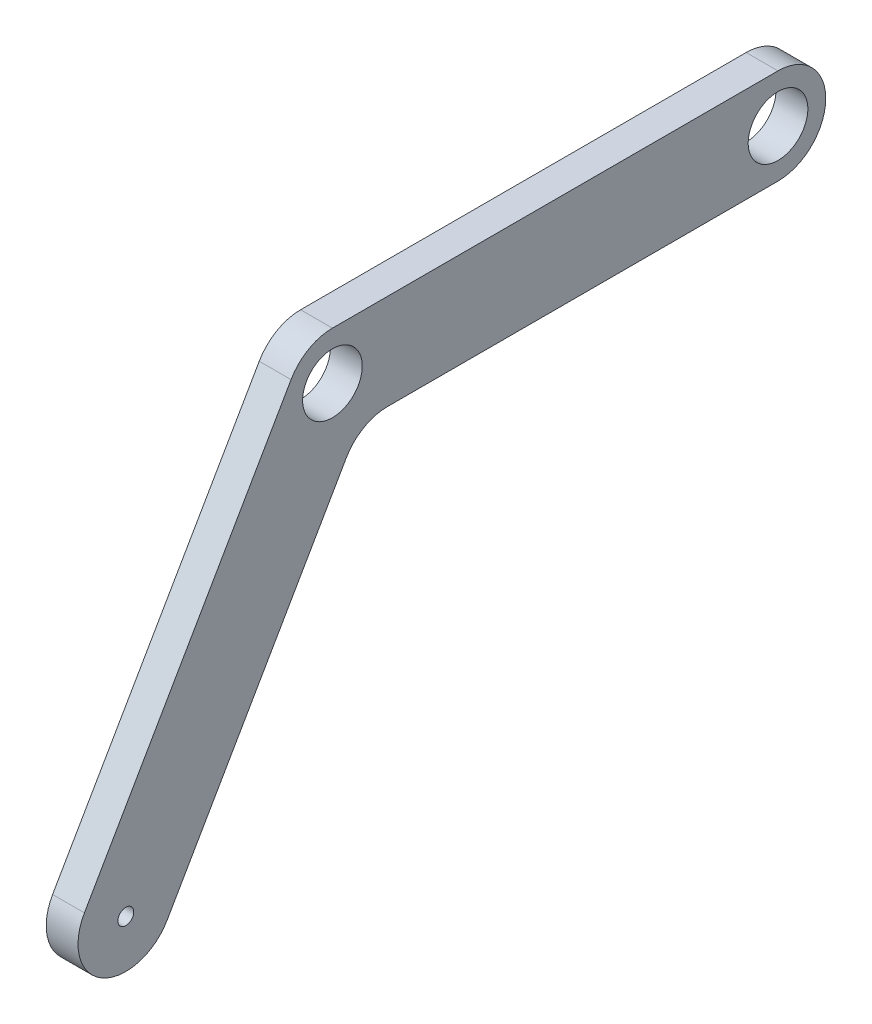
from build123d import *

# Parameters (mm, degrees)
SKETCH1_R           = 46.875
SKETCH1_R_2         = 12.5
BOSS_EXTRUDE1_DEPTH = 50


with BuildPart() as part:
    # Sketch1 → Boss-Extrude1 (new body)
    with BuildSketch(Plane.ZY):
        with BuildLine():
            Line((-86.671705253, -75), (-700, -75))
            ThreePointArc((-700, -75), (-775, 0), (-700, 75))
            Line((-700, 75), (0, 75))
            ThreePointArc((0, 75), (37.522455225, 64.938935577), (64.977821402, 37.455076103))
            Line((64.977821402, 37.455076103), (389.588480961, -525.686042712))
            ThreePointArc((389.588480961, -525.686042712), (362.065735663, -628.118940217), (259.632838158, -600.596194918))
            Line((259.632838158, -600.596194918), (-21.693883852, -112.544923897))
            ThreePointArc((-21.693883852, -112.544923897), (-49.149250028, -85.061064423), (-86.671705253, -75))
        make_face()
        with Locations((-700, 0)):
            Circle(SKETCH1_R, mode=Mode.SUBTRACT)
        Circle(SKETCH1_R, mode=Mode.SUBTRACT)
        with Locations((324.61065956, -563.141118815)):
            Circle(SKETCH1_R_2, mode=Mode.SUBTRACT)
    extrude(amount=BOSS_EXTRUDE1_DEPTH)


solid = part.part
